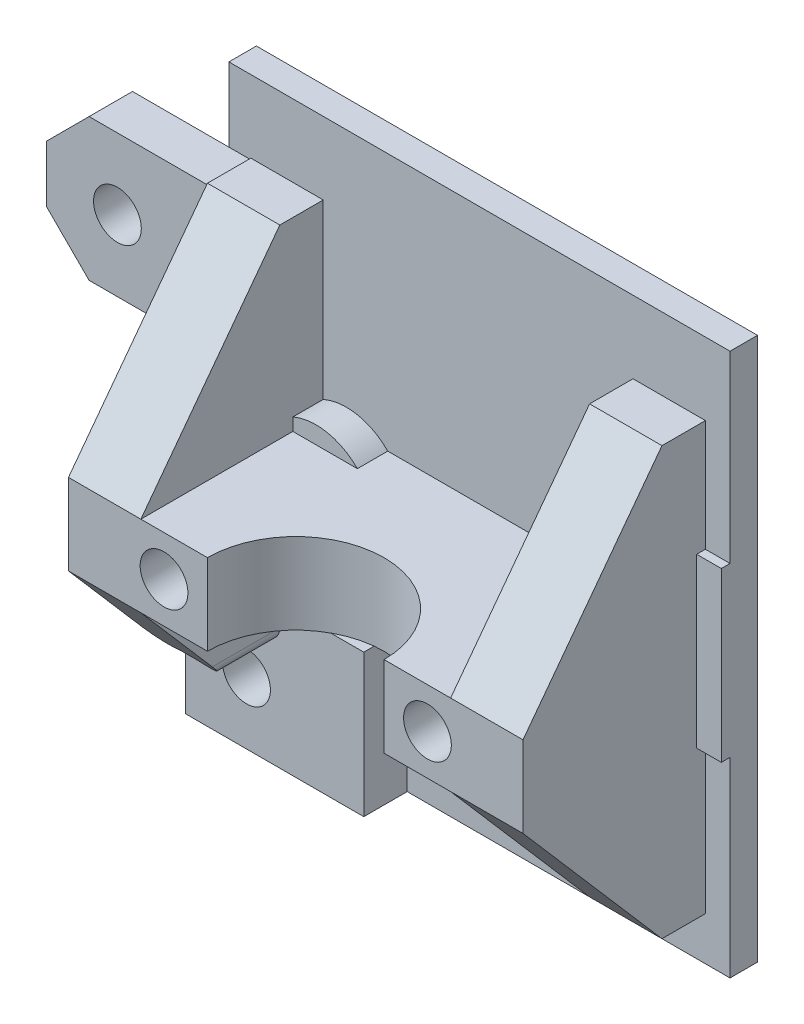
from build123d import *
from build123d.topology import SkipClean

# Parameters (mm, degrees)
BOSS_EXTRUDE1_START = 0.2
BOSS_EXTRUDE1_DEPTH = 5.6
BOSS_EXTRUDE2_DEPTH = 1.9
SKETCH5_R           = 1.65
BOSS_EXTRUDE3_DEPTH = 3
SKETCH6_W           = 5.7
SKETCH6_H           = 11.6
BOSS_EXTRUDE4_DEPTH = 0.6
BOSS_EXTRUDE5_START = -2
BOSS_EXTRUDE5_DEPTH = 5
SKETCH3_R           = 1.65
CUT_EXTRUDE1_DEPTH  = 50
BOSS_EXTRUDE6_START = -4
SKETCH10_R          = 4
SKETCH10_R_2        = 1.65
BOSS_EXTRUDE6_DEPTH = 4
CUT_EXTRUDE3_DEPTH  = 3
SKETCH13_R          = 1.65
CUT_EXTRUDE4_DEPTH  = 10
SKETCH14_R          = 3.25
CUT_EXTRUDE5_DEPTH  = 10
FILLET1_R           = 1


with BuildPart() as part:
    # Sketch2 → Boss-Extrude1 (new body)
    with BuildSketch(Plane.XZ.offset(22.088801204).offset(BOSS_EXTRUDE1_START)):
        with BuildLine():
            ThreePointArc((19.781498191, 14.5), (13.681498191, 8.4), (7.581498191, 14.5))
            Line((7.581498191, 14.5), (2.581498191, 14.5))
            Line((2.581498191, 14.5), (0.981498191, 14.5))
            Line((0.981498191, 14.5), (0.981498191, 0))
            Line((0.981498191, 0), (26.381498191, 0))
            Line((26.381498191, 0), (26.381498191, 14.5))
            Line((26.381498191, 14.5), (24.781498191, 14.5))
            Line((24.781498191, 14.5), (19.781498191, 14.5))
        make_face()
    extrude(amount=BOSS_EXTRUDE1_DEPTH)

    # Sketch4 → Boss-Extrude2 (add)
    with BuildSketch(Plane.XY):
        Polygon((5.781498191, -39.638801204), (5.781498191, -41.988801204), (31.081498191, -41.988801204), (31.081498191, -4.488801204), (-3.537114605, -4.488801204), (-3.537114605, -33.288801204), (2.722919547, -33.288801204), (5.781498191, -36.347379848), align=None)
    extrude(amount=BOSS_EXTRUDE2_DEPTH)

    # Sketch5 → Boss-Extrude3 (add)
    # profile 1 of 2: a face of its own
    with BuildSketch(Plane.XY.offset(1.9)):
        Polygon((-3.737114605, -9.588801204), (-10.195693249, -9.588801204), (-13.137114605, -12.53022256), (-13.137114605, -16.447379848), (-10.195693249, -19.388801204), (-3.737114605, -19.388801204), (-0.537114605, -19.388801204), (-0.537114605, -9.588801204), align=None)
        with Locations((-8.237114605, -14.488801204)):
            Circle(SKETCH5_R, mode=Mode.SUBTRACT)
    # profile 2 of 2: a face of its own
    with BuildSketch(Plane.XY.offset(1.9)):
        Polygon((5.781498191, -41.988801204), (-3.537114605, -41.988801204), (-3.537114605, -33.488801204), (-3.537114605, -32.143344659), (8.781498191, -32.143344659), (8.781498191, -41.988801204), align=None)
        with Locations((0.681498191, -37.638801204)):
            Circle(SKETCH5_R, mode=Mode.SUBTRACT)
    extrude(amount=BOSS_EXTRUDE3_DEPTH)

    # Sketch6 → Boss-Extrude4 (add)
    with BuildSketch(Plane.XY.offset(1.9)):
        with Locations((28.231498191, -22.988801204)):
            Rectangle(SKETCH6_W, SKETCH6_H)
    extrude(amount=BOSS_EXTRUDE4_DEPTH)

    # Sketch9 → Boss-Extrude5 (add)
    with BuildSketch(Plane(origin=(26.381498191, 0, 0), x_dir=(0, 0, -1), z_dir=(1, 0, 0)).offset(BOSS_EXTRUDE5_START)):
        Polygon((-1.9, -38.988801204), (-4.9, -38.988801204), (-14.5, -27.888801204), (-14.5, -22.288801204), (-4.9, -9.488801204), (-1.9, -9.488801204), align=None)
    boss_extrude5 = extrude(amount=BOSS_EXTRUDE5_DEPTH)

    # Sketch3 → Cut-Extrude1 (cut)
    with BuildSketch(Plane.XY.offset(14.5)):
        with Locations((22.781498191, -25.088801204)):
            Circle(SKETCH3_R)
    cut_extrude1 = extrude(amount=-CUT_EXTRUDE1_DEPTH, mode=Mode.SUBTRACT)

    # Sketch10 → Boss-Extrude6 (add)
    with BuildSketch(Plane(origin=(0, 0, 0), x_dir=(-1, 0, 0), z_dir=(0, 0, -1)).offset(BOSS_EXTRUDE6_START)):
        with Locations((-22.781498191, -25.088801204)):
            Circle(SKETCH10_R)
        with Locations(Location((-22.781498191, -25.088801204, 0), (0, 0, 180))):
            Circle(SKETCH10_R_2, mode=Mode.SUBTRACT)
    boss_extrude6 = extrude(amount=BOSS_EXTRUDE6_DEPTH)

    # Sketch11 → Cut-Extrude3 (cut)
    with BuildSketch(Plane(origin=(0, 0, 0), x_dir=(-1, 0, 0), z_dir=(0, 0, -1))):
        Polygon((-22.781498191, -21.913374723), (-25.531498191, -23.501087964), (-25.531498191, -26.676514444), (-22.781498191, -28.264227685), (-20.031498191, -26.676514444), (-20.031498191, -23.501087964), align=None)
    cut_extrude3 = extrude(amount=-CUT_EXTRUDE3_DEPTH, mode=Mode.SUBTRACT)

    # Mirror1: Boss-Extrude5, Cut-Extrude1, Boss-Extrude6, Cut-Extrude3 across plane
    add(boss_extrude5.mirror(Plane(origin=(13.681498191, 0, 0), x_dir=(0, 0, 1), z_dir=(1, 0, 0))))
    add(cut_extrude1.mirror(Plane(origin=(13.681498191, 0, 0), x_dir=(0, 0, 1), z_dir=(1, 0, 0))), mode=Mode.SUBTRACT)
    add(boss_extrude6.mirror(Plane(origin=(13.681498191, 0, 0), x_dir=(0, 0, 1), z_dir=(1, 0, 0))))
    add(cut_extrude3.mirror(Plane(origin=(13.681498191, 0, 0), x_dir=(0, 0, 1), z_dir=(1, 0, 0))), mode=Mode.SUBTRACT)

    # Sketch13 → Cut-Extrude4 (cut)
    with SkipClean():  # the faces are left unmerged after this step: merging them gives an invalid solid
        with BuildSketch(Plane(origin=(0, 0, 1.9), x_dir=(-1, 0, 0), z_dir=(0, 0, -1))):
            with Locations(Location((-0.681498191, -37.638801204, 0), (0, 0, 305.096801228))):
                Circle(SKETCH13_R)
        extrude(amount=-CUT_EXTRUDE4_DEPTH, mode=Mode.SUBTRACT)

    # Sketch14 → Cut-Extrude5 (cut)
    with SkipClean():  # the faces are left unmerged after this step: merging them gives an invalid solid
        with BuildSketch(Plane.XY.offset(4.9)):
            with Locations((0.681498191, -37.638801204)):
                Circle(SKETCH14_R)
        extrude(amount=CUT_EXTRUDE5_DEPTH, mode=Mode.SUBTRACT)

    # Fillet1
    fillet1_edges = [part.edges().sort_by_distance(p)[0] for p in [
        (2.981498191, -35.342608703, 6.476731892),
        (-2.018501809, -35.829795952, 6.266056325),
    ]]
    fillet(fillet1_edges, radius=FILLET1_R)


solid = part.part
